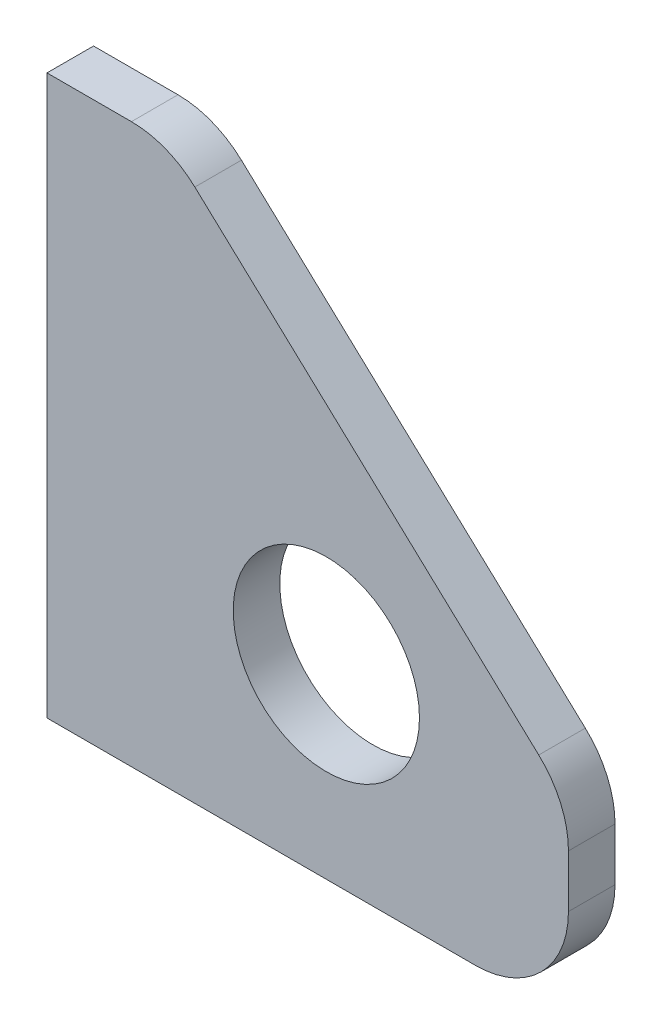
from build123d import *

# Parameters (mm, degrees)
SKETCH1_R           = 10
BOSS_EXTRUDE1_DEPTH = 5
FILLET1_R           = 10


with BuildPart() as part:
    # Sketch1 → Boss-Extrude1 (new body)
    with BuildSketch(Plane.XY):
        Polygon((0, -20), (-30, -20), (-30, 40), (-17, 40), (26, 0), (26, -20), align=None)
        Circle(SKETCH1_R, mode=Mode.SUBTRACT)
    extrude(amount=BOSS_EXTRUDE1_DEPTH)

    # Fillet1
    fillet1_edges = [part.edges().sort_by_distance(p)[0] for p in [
        (-17, 40, 2.5),
        (26, 0, 2.5),
        (26, -20, 2.5),
    ]]
    fillet(fillet1_edges, radius=FILLET1_R)


solid = part.part
